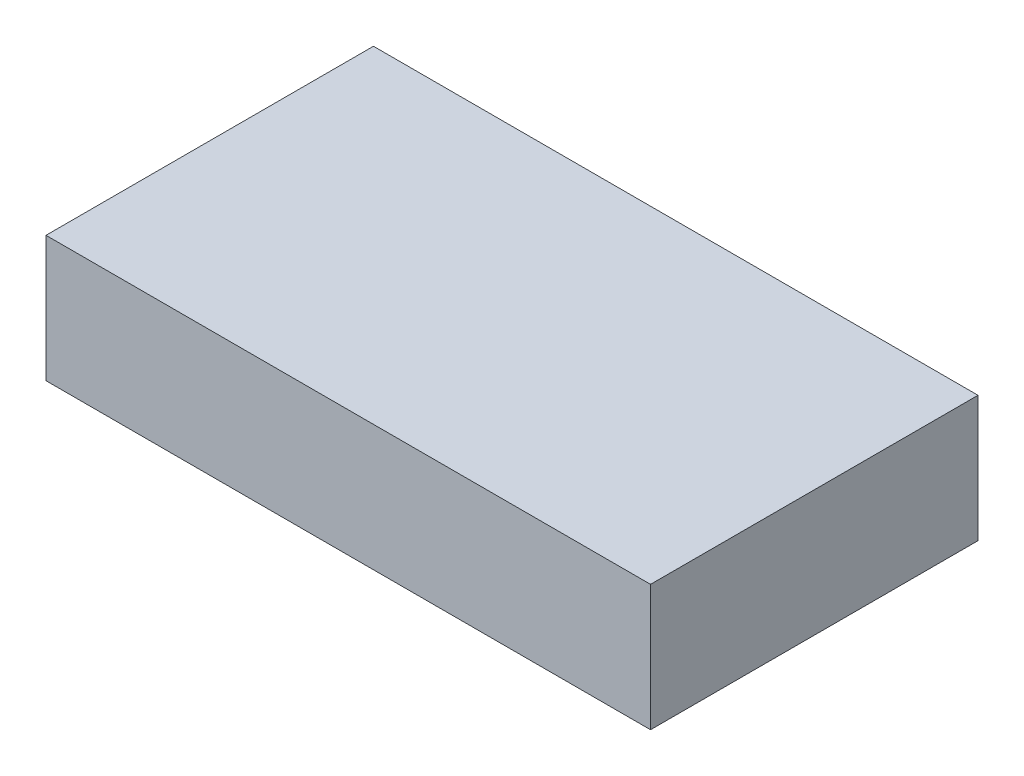
from build123d import *

# Parameters (mm, degrees)
SKETCH1_W           = 24
SKETCH1_H           = 13
BOSS_EXTRUDE1_DEPTH = 2.5


with BuildPart() as part:
    # Sketch1 → Boss-Extrude1 (new, symmetric)
    with BuildSketch(Plane(origin=(0, 0, 0), x_dir=(1, 0, 0), z_dir=(0, 1, 0))):
        Rectangle(SKETCH1_W, SKETCH1_H)
    extrude(amount=BOSS_EXTRUDE1_DEPTH, both=True)


solid = part.part
